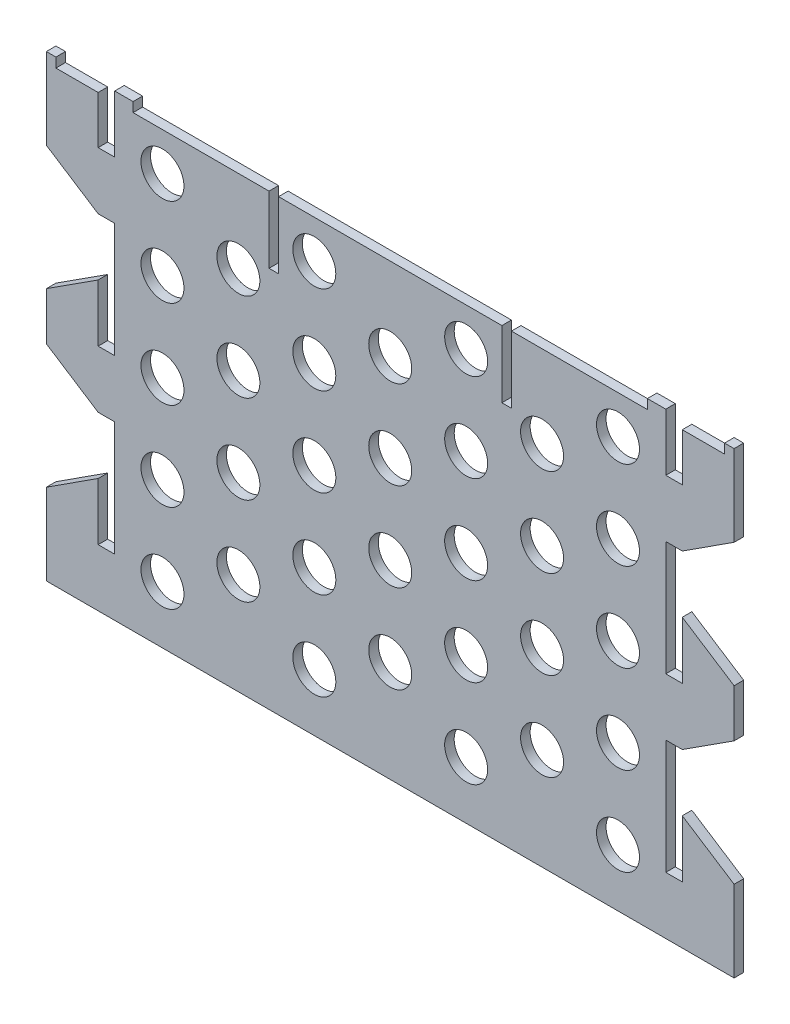
from build123d import *

# Parameters (mm, degrees)
SKETCH1_W           = 762
SKETCH1_H           = 12.7
BOSS_EXTRUDE1_DEPTH = 609.6
SKETCH2_W           = 12.7
SKETCH2_H           = 609.6
BOSS_EXTRUDE2_DEPTH = 76.2
SKETCH3_OUTSIDE_W   = 1136.21
SKETCH3_OUTSIDE_H   = 831.41
CUT_EXTRUDE1_DEPTH  = 12.7
SKETCH6_W           = 56.167651581
SKETCH6_H           = 12.7
SKETCH6_W_2         = 683.835303162
CUT_EXTRUDE2_DEPTH  = 12.7
CUT_EXTRUDE5_DEPTH  = 12.7
SKETCH7_W           = 12.7
SKETCH7_H           = 88.9
CUT_EXTRUDE3_DEPTH  = 12.7
SKETCH10_R          = 28.575
CUT_EXTRUDE4_DEPTH  = 763.105825985
BOSS_EXTRUDE5_START = -88.9
SKETCH11_W          = 12.7
SKETCH11_H          = 12.7
BOSS_EXTRUDE5_DEPTH = 88.9
SKETCH12_W          = 56.167651581
SKETCH12_H          = 12.7
SKETCH12_W_2        = 683.835303162
BOSS_EXTRUDE6_DEPTH = 12.7


with BuildPart() as part:
    # Sketch1 → Boss-Extrude1 (new body)
    with BuildSketch(Plane(origin=(0, 0, 0), x_dir=(1, 0, 0), z_dir=(0, 1, 0))):
        with Locations((0, -653.561357684)):
            Rectangle(SKETCH1_W, SKETCH1_H)
    extrude(amount=BOSS_EXTRUDE1_DEPTH)

    # Sketch2 → Boss-Extrude2 (add)
    with BuildSketch(Plane(origin=(381, 0, 0), x_dir=(0, 0, -1), z_dir=(1, 0, 0))):
        with Locations((-653.561357684, 304.8)):
            Rectangle(SKETCH2_W, SKETCH2_H)
    boss_extrude2 = extrude(amount=BOSS_EXTRUDE2_DEPTH)

    # Mirror1: Boss-Extrude2 across plane
    add(boss_extrude2.mirror(Plane(origin=(0, 0, 0), x_dir=(0, 0, 1), z_dir=(1, 0, 0))))

    # Sketch3 outside → Cut-Extrude1 (cut)
    with BuildSketch(Plane.XY.offset(659.911357684)):
        with Locations((0, 304.8)):
            Rectangle(SKETCH3_OUTSIDE_W, SKETCH3_OUTSIDE_H)
        Polygon((366.335303163, 609.6), (-366.335303163, 609.6), (-366.335303163, 533.4), (-388.332348419, 533.4), (-388.332348419, 609.6), (-457.2, 609.6), (-457.2, 457.2), (-366.335303163, 457.2), (-366.335303163, 304.8), (-388.332348419, 304.8), (-388.332348419, 381), (-457.2, 381), (-457.2, 228.6), (-366.335303163, 228.6), (-366.335303163, 76.2), (-388.332348419, 76.2), (-388.332348419, 152.4), (-457.2, 152.4), (-457.2, 0), (457.2, 0), (457.2, 152.4), (388.332348419, 152.4), (388.332348419, 76.2), (366.335303163, 76.2), (366.335303163, 228.6), (457.2, 228.6), (457.2, 381), (388.332348419, 381), (388.332348419, 304.8), (366.335303163, 304.8), (366.335303163, 457.2), (457.2, 457.2), (457.2, 609.6), (388.332348419, 609.6), (388.332348419, 533.4), (366.335303163, 533.4), align=None, mode=Mode.SUBTRACT)
    extrude(amount=-CUT_EXTRUDE1_DEPTH, mode=Mode.SUBTRACT)

    # Sketch6 → Cut-Extrude2 (cut)
    with BuildSketch(Plane(origin=(0, 609.6, 0), x_dir=(1, 0, 0), z_dir=(0, 1, 0))):
        with Locations((-416.41617421, -653.561357684)):
            Rectangle(SKETCH6_W, SKETCH6_H)
        with Locations((0, -653.561357684)):
            Rectangle(SKETCH6_W_2, SKETCH6_H)
        with Locations((416.41617421, -653.561357684)):
            Rectangle(SKETCH6_W, SKETCH6_H)
    cut_extrude2 = extrude(amount=-CUT_EXTRUDE2_DEPTH, mode=Mode.SUBTRACT)

    # Sketch14 → Cut-Extrude5 (cut)
    with BuildSketch(Plane.XY.offset(659.911357684)):
        Polygon((-388.332348419, 457.2), (-457.2, 501.65), (-457.2, 457.2), align=None)
        Polygon((-388.332348419, 381), (-457.2, 336.55), (-457.2, 381), align=None)
        Polygon((-388.332348419, 152.4), (-457.2, 107.95), (-457.2, 152.4), align=None)
        Polygon((457.2, 152.4), (388.332348419, 152.4), (457.2, 107.95), align=None)
        Polygon((457.2, 381), (388.332348419, 381), (457.2, 336.55), align=None)
        Polygon((457.2, 457.2), (388.332348419, 457.2), (457.2, 501.65), align=None)
        Polygon((-457.2, 273.05), (-388.332348419, 228.6), (-457.2, 228.6), align=None)
        Polygon((388.332348419, 228.6), (457.2, 228.6), (457.2, 273.05), align=None)
    extrude(amount=-CUT_EXTRUDE5_DEPTH, mode=Mode.SUBTRACT)

    # Sketch7 → Cut-Extrude3 (cut)
    with BuildSketch(Plane.XY.offset(659.911357684)):
        with Locations((154.820606325, 552.45)):
            Rectangle(SKETCH7_W, SKETCH7_H)
        with Locations((-154.820606325, 552.45)):
            Rectangle(SKETCH7_W, SKETCH7_H)
    cut_extrude3 = extrude(amount=-CUT_EXTRUDE3_DEPTH, mode=Mode.SUBTRACT)

    # Mirror2: Cut-Extrude2, Cut-Extrude3 across plane
    add(cut_extrude2.mirror(Plane(origin=(0, 304.8, 0), x_dir=(0, 0, 1), z_dir=(0, -1, 0))), mode=Mode.SUBTRACT)
    add(cut_extrude3.mirror(Plane(origin=(0, 304.8, 0), x_dir=(0, 0, 1), z_dir=(0, -1, 0))), mode=Mode.SUBTRACT)

    # Sketch10 → Cut-Extrude4 (cut, through all)
    with BuildSketch(Plane.XY.offset(659.911357684)):
        with Locations((-302.835303163, 311.15)):
            Circle(SKETCH10_R)
        with Locations((-302.835303163, 193.675)):
            Circle(SKETCH10_R)
        with Locations((-302.835303163, 76.2)):
            Circle(SKETCH10_R)
        with Locations(Location((-100.945101054, 76.2, 0), (0, 0, 180))):
            Circle(SKETCH10_R)
        with Locations(Location((-100.945101054, 193.675, 0), (0, 0, 180))):
            Circle(SKETCH10_R)
        with Locations(Location((-100.945101054, 311.15, 0), (0, 0, 180))):
            Circle(SKETCH10_R)
        with Locations((-201.890202108, 252.4125)):
            Circle(SKETCH10_R)
        with Locations((-201.890202108, 134.9375)):
            Circle(SKETCH10_R)
        with Locations((100.945101054, 193.675)):
            Circle(SKETCH10_R)
        with Locations((302.835303163, 193.675)):
            Circle(SKETCH10_R)
        with Locations((100.945101054, 311.15)):
            Circle(SKETCH10_R)
        with Locations((302.835303163, 311.15)):
            Circle(SKETCH10_R)
        with Locations((100.945101054, 76.2)):
            Circle(SKETCH10_R)
        with Locations((302.835303163, 76.2)):
            Circle(SKETCH10_R)
        with Locations((0, 134.9375)):
            Circle(SKETCH10_R)
        with Locations((0, 252.4125)):
            Circle(SKETCH10_R)
        with Locations((201.890202108, 252.4125)):
            Circle(SKETCH10_R)
        with Locations((201.890202108, 134.9375)):
            Circle(SKETCH10_R)
        with Locations(Location((302.835303163, 546.1, 0), (0, 0, 180))):
            Circle(SKETCH10_R)
        with Locations(Location((302.835303163, 428.625, 0), (0, 0, 180))):
            Circle(SKETCH10_R)
        with Locations(Location((201.890202108, 369.8875, 0), (0, 0, 180))):
            Circle(SKETCH10_R)
        with Locations(Location((201.890202108, 487.3625, 0), (0, 0, 180))):
            Circle(SKETCH10_R)
        with Locations(Location((100.945101054, 546.1, 0), (0, 0, 180))):
            Circle(SKETCH10_R)
        with Locations(Location((100.945101054, 428.625, 0), (0, 0, 180))):
            Circle(SKETCH10_R)
        with Locations(Location((0, 487.3625, 0), (0, 0, 180))):
            Circle(SKETCH10_R)
        with Locations(Location((0, 369.8875, 0), (0, 0, 180))):
            Circle(SKETCH10_R)
        with Locations((-100.945101054, 428.625)):
            Circle(SKETCH10_R)
        with Locations((-100.945101054, 546.1)):
            Circle(SKETCH10_R)
        with Locations(Location((-201.890202108, 487.3625, 0), (0, 0, 180))):
            Circle(SKETCH10_R)
        with Locations(Location((-302.835303163, 546.1, 0), (0, 0, 180))):
            Circle(SKETCH10_R)
        with Locations(Location((-302.835303163, 428.625, 0), (0, 0, 180))):
            Circle(SKETCH10_R)
        with Locations(Location((-201.890202108, 369.8875, 0), (0, 0, 180))):
            Circle(SKETCH10_R)
    extrude(amount=-CUT_EXTRUDE4_DEPTH, mode=Mode.SUBTRACT)

    # Sketch11 → Boss-Extrude5 (add)
    with BuildSketch(Plane.XZ.offset(-12.7).offset(BOSS_EXTRUDE5_START)):
        with Locations((154.820606325, 653.561357684)):
            Rectangle(SKETCH11_W, SKETCH11_H)
        with Locations((-154.820606325, 653.561357684)):
            Rectangle(SKETCH11_W, SKETCH11_H)
    extrude(amount=BOSS_EXTRUDE5_DEPTH)

    # Sketch12 → Boss-Extrude6 (add)
    with BuildSketch(Plane.XZ.offset(-12.7)):
        with Locations((416.41617421, 653.561357684)):
            Rectangle(SKETCH12_W, SKETCH12_H)
        with Locations((-416.41617421, 653.561357684)):
            Rectangle(SKETCH12_W, SKETCH12_H)
        with Locations((0, 653.561357684)):
            Rectangle(SKETCH12_W_2, SKETCH12_H)
    extrude(amount=BOSS_EXTRUDE6_DEPTH)


solid = part.part
